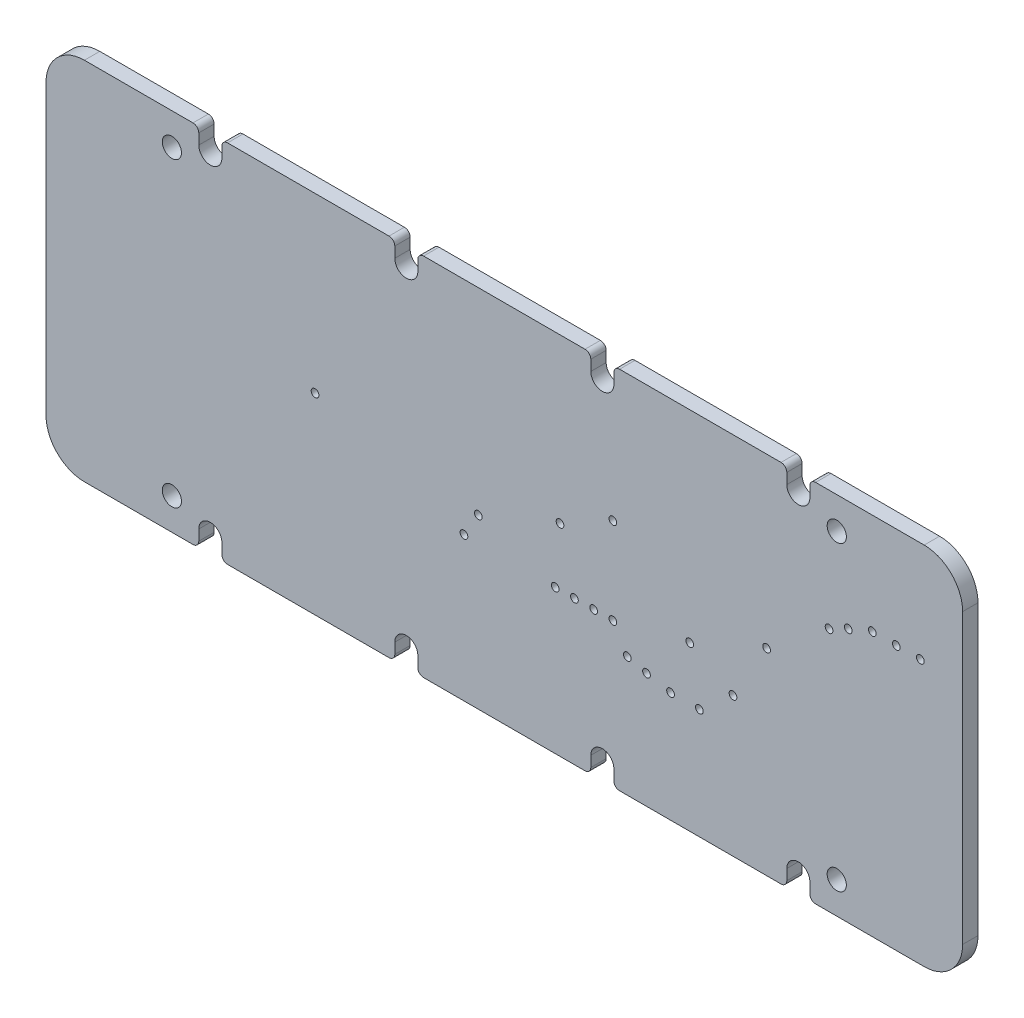
from build123d import *

# Parameters (mm, degrees)
BOARD_DEPTH            = 0.8
SKETCH2_R              = 0.5
NON_PLATED_HOLES_DEPTH = 52.351046727
SKETCH3_R              = 0.2
PLATED_HOLES_DEPTH     = 52.351046727


with BuildPart() as part:
    # Sketch1 → BOARD (new body)
    with BuildSketch(Plane.XY):
        with BuildLine():
            Line((7.65, 0), (2, 0))
            ThreePointArc((2, 0), (0.585786438, 0.585786438), (0, 2))
            Line((0, 2), (0, 17))
            ThreePointArc((0, 17), (0.585786438, 18.414213562), (2, 19))
            Line((2, 19), (7.65, 19))
            ThreePointArc((7.65, 19), (7.862132034, 18.912132034), (7.95, 18.7))
            Line((7.95, 18.7), (7.95, 18.15))
            ThreePointArc((7.95, 18.15), (8.125735931, 17.725735931), (8.55, 17.55))
            ThreePointArc((8.55, 17.55), (8.974264069, 17.725735931), (9.15, 18.15))
            Line((9.15, 18.15), (9.15, 18.7))
            ThreePointArc((9.15, 18.7), (9.237867966, 18.912132034), (9.45, 19))
            Line((9.45, 19), (17.85, 19))
            ThreePointArc((17.85, 19), (18.062132034, 18.912132034), (18.15, 18.7))
            Line((18.15, 18.7), (18.15, 18.15))
            ThreePointArc((18.15, 18.15), (18.325735931, 17.725735931), (18.75, 17.55))
            ThreePointArc((18.75, 17.55), (19.174264069, 17.725735931), (19.35, 18.15))
            Line((19.35, 18.15), (19.35, 18.7))
            ThreePointArc((19.35, 18.7), (19.437867966, 18.912132034), (19.65, 19))
            Line((19.65, 19), (28.05, 19))
            ThreePointArc((28.05, 19), (28.262132034, 18.912132034), (28.35, 18.7))
            Line((28.35, 18.7), (28.35, 18.15))
            ThreePointArc((28.35, 18.15), (28.525735931, 17.725735931), (28.95, 17.55))
            ThreePointArc((28.95, 17.55), (29.374264069, 17.725735931), (29.55, 18.15))
            Line((29.55, 18.15), (29.55, 18.7))
            ThreePointArc((29.55, 18.7), (29.637867966, 18.912132034), (29.85, 19))
            Line((29.85, 19), (38.25, 19))
            ThreePointArc((38.25, 19), (38.462132034, 18.912132034), (38.55, 18.7))
            Line((38.55, 18.7), (38.55, 18.15))
            ThreePointArc((38.55, 18.15), (38.725735931, 17.725735931), (39.15, 17.55))
            ThreePointArc((39.15, 17.55), (39.574264069, 17.725735931), (39.75, 18.15))
            Line((39.75, 18.15), (39.75, 18.7))
            ThreePointArc((39.75, 18.7), (39.837867966, 18.912132034), (40.05, 19))
            Line((40.05, 19), (45.7, 19))
            ThreePointArc((45.7, 19), (47.114213562, 18.414213562), (47.7, 17))
            Line((47.7, 17), (47.7, 2))
            ThreePointArc((47.7, 2), (47.114213562, 0.585786438), (45.7, 0))
            Line((45.7, 0), (40.05, 0))
            ThreePointArc((40.05, 0), (39.837867966, 0.087867966), (39.75, 0.3))
            Line((39.75, 0.3), (39.75, 0.85))
            ThreePointArc((39.75, 0.85), (39.574264069, 1.274264069), (39.15, 1.45))
            ThreePointArc((39.15, 1.45), (38.725735931, 1.274264069), (38.55, 0.85))
            Line((38.55, 0.85), (38.55, 0.3))
            ThreePointArc((38.55, 0.3), (38.462132034, 0.087867966), (38.25, 0))
            Line((38.25, 0), (29.85, 0))
            ThreePointArc((29.85, 0), (29.637867966, 0.087867966), (29.55, 0.3))
            Line((29.55, 0.3), (29.55, 0.85))
            ThreePointArc((29.55, 0.85), (29.374264069, 1.274264069), (28.95, 1.45))
            ThreePointArc((28.95, 1.45), (28.525735931, 1.274264069), (28.35, 0.85))
            Line((28.35, 0.85), (28.35, 0.3))
            ThreePointArc((28.35, 0.3), (28.262132034, 0.087867966), (28.05, 0))
            Line((28.05, 0), (19.65, 0))
            ThreePointArc((19.65, 0), (19.437867966, 0.087867966), (19.35, 0.3))
            Line((19.35, 0.3), (19.35, 0.85))
            ThreePointArc((19.35, 0.85), (19.174264069, 1.274264069), (18.75, 1.45))
            ThreePointArc((18.75, 1.45), (18.325735931, 1.274264069), (18.15, 0.85))
            Line((18.15, 0.85), (18.15, 0.3))
            ThreePointArc((18.15, 0.3), (18.062132034, 0.087867966), (17.85, 0))
            Line((17.85, 0), (9.45, 0))
            ThreePointArc((9.45, 0), (9.237867966, 0.087867966), (9.15, 0.3))
            Line((9.15, 0.3), (9.15, 0.85))
            ThreePointArc((9.15, 0.85), (8.974264069, 1.274264069), (8.55, 1.45))
            ThreePointArc((8.55, 1.45), (8.125735931, 1.274264069), (7.95, 0.85))
            Line((7.95, 0.85), (7.95, 0.3))
            ThreePointArc((7.95, 0.3), (7.862132034, 0.087867966), (7.65, 0))
        make_face()
    extrude(amount=BOARD_DEPTH)

    # Sketch2 → NON-PLATED HOLES (cut, through all)
    with BuildSketch(Plane.XY):
        with Locations((6.55, 17.35)):
            Circle(SKETCH2_R)
        with Locations((6.55, 1.65)):
            Circle(SKETCH2_R)
        with Locations((41.15, 17.35)):
            Circle(SKETCH2_R)
        with Locations((41.15, 1.65)):
            Circle(SKETCH2_R)
    extrude(amount=NON_PLATED_HOLES_DEPTH, mode=Mode.SUBTRACT)

    # Sketch3 → PLATED HOLES (cut, through all)
    with BuildSketch(Plane.XY):
        with Locations((37.5, 10.25)):
            Circle(SKETCH3_R)
        with Locations((26.75, 10.5)):
            Circle(SKETCH3_R)
        with Locations((14, 10)):
            Circle(SKETCH3_R)
        with Locations((30.25, 6.25)):
            Circle(SKETCH3_R)
        with Locations((31.25, 6)):
            Circle(SKETCH3_R)
        with Locations((32.5, 5.75)):
            Circle(SKETCH3_R)
        with Locations((34, 5.75)):
            Circle(SKETCH3_R)
        with Locations((33.5, 8.5)):
            Circle(SKETCH3_R)
        with Locations((35.75, 7.25)):
            Circle(SKETCH3_R)
        with Locations((21.75, 7.5)):
            Circle(SKETCH3_R)
        with Locations((22.5, 8.75)):
            Circle(SKETCH3_R)
        with Locations((29.5, 7.5)):
            Circle(SKETCH3_R)
        with Locations((28.5, 7.5)):
            Circle(SKETCH3_R)
        with Locations((27.5, 7.5)):
            Circle(SKETCH3_R)
        with Locations((26.5, 7.5)):
            Circle(SKETCH3_R)
        with Locations((29.5, 12)):
            Circle(SKETCH3_R)
        with Locations((40.75, 12.75)):
            Circle(SKETCH3_R)
        with Locations((41.75, 13.25)):
            Circle(SKETCH3_R)
        with Locations((43, 13.75)):
            Circle(SKETCH3_R)
        with Locations((44.25, 13.75)):
            Circle(SKETCH3_R)
        with Locations((45.5, 13.75)):
            Circle(SKETCH3_R)
    extrude(amount=PLATED_HOLES_DEPTH, mode=Mode.SUBTRACT)


solid = part.part
